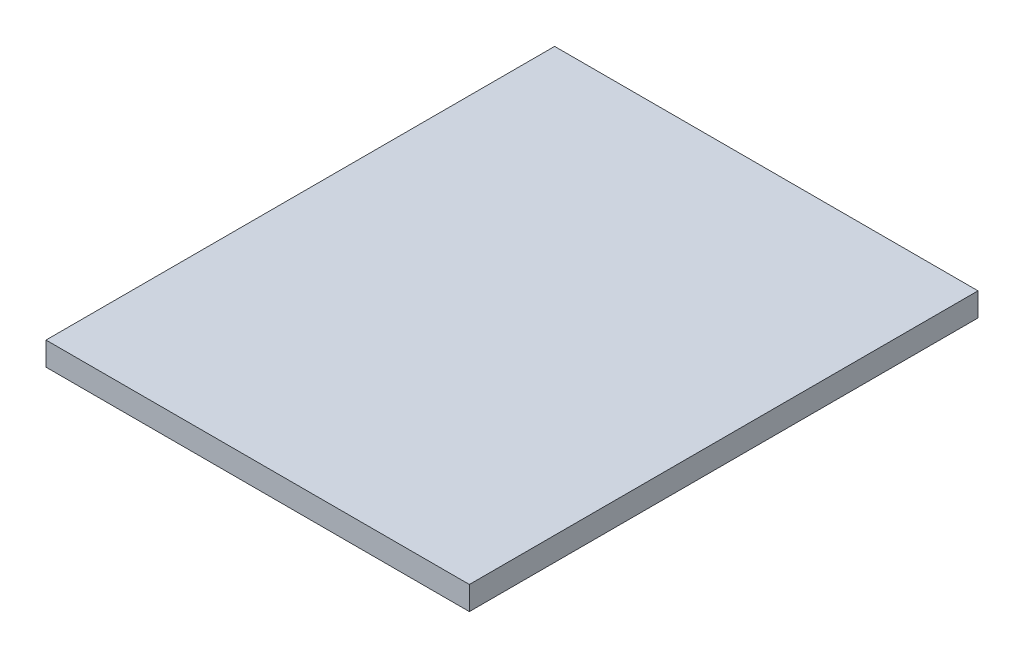
from build123d import *

# Parameters (mm, degrees)
SKETCH1_W           = 72
SKETCH1_H           = 86.5
BOSS_EXTRUDE1_DEPTH = 4


with BuildPart() as part:
    # Sketch1 → Boss-Extrude1 (new body)
    with BuildSketch(Plane(origin=(0, 0, 0), x_dir=(1, 0, 0), z_dir=(0, 1, 0))):
        Rectangle(SKETCH1_W, SKETCH1_H)
    extrude(amount=BOSS_EXTRUDE1_DEPTH)


solid = part.part
